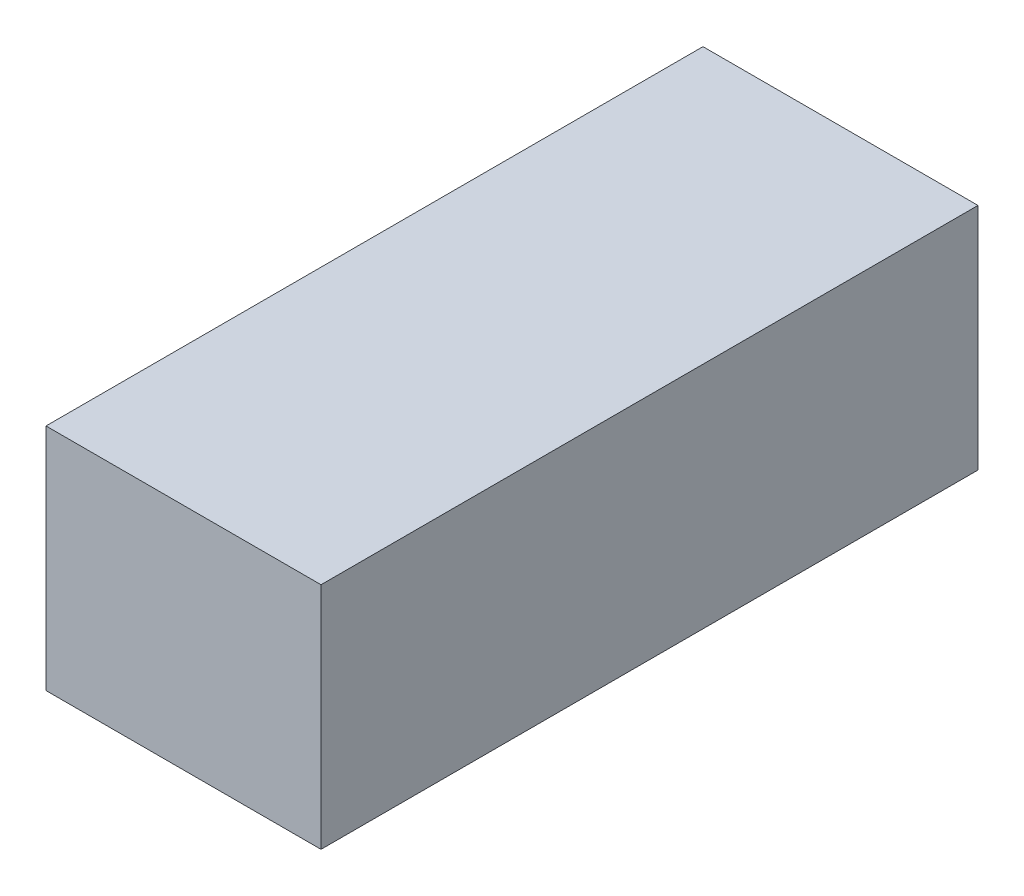
from build123d import *

# Parameters (mm, degrees)
SKETCH1_W           = 18
SKETCH1_H           = 15
BOSS_EXTRUDE1_DEPTH = 21.5


with BuildPart() as part:
    # Sketch1 → Boss-Extrude1 (new, symmetric)
    with BuildSketch(Plane.XY):
        with Locations((0, 7.5)):
            Rectangle(SKETCH1_W, SKETCH1_H)
    extrude(amount=BOSS_EXTRUDE1_DEPTH, both=True)


solid = part.part
